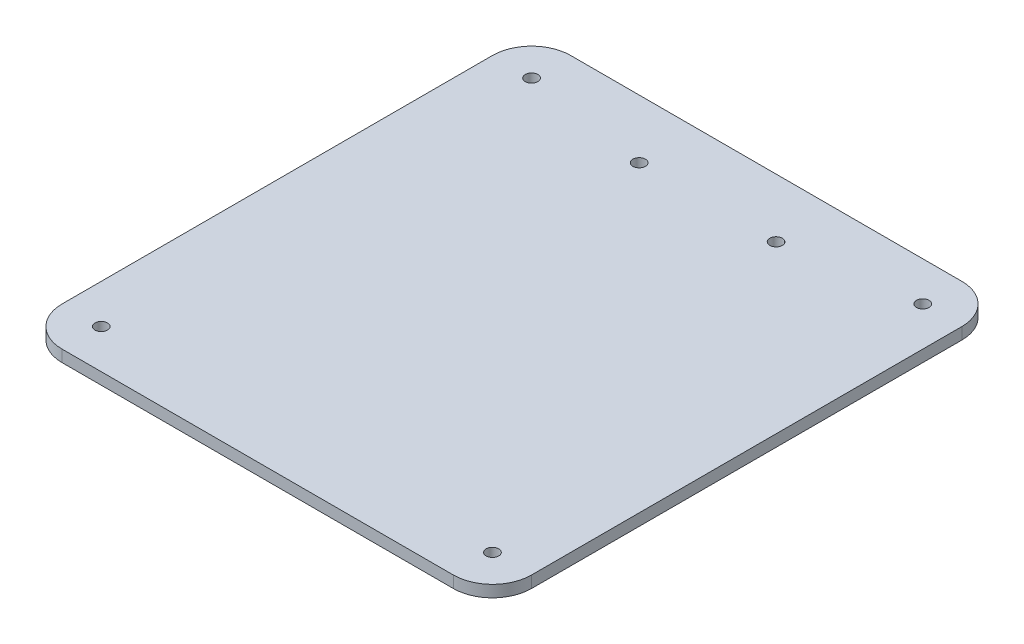
from build123d import *

# Parameters (mm, degrees)
SKETCH1_R           = 1.6
BOSS_EXTRUDE1_DEPTH = 3
SKETCH2_R           = 1.6
CUT_EXTRUDE1_DEPTH  = 89.509886453


with BuildPart() as part:
    # Sketch1 → Boss-Extrude1 (new body)
    with BuildSketch(Plane(origin=(0, 0, 0), x_dir=(1, 0, 0), z_dir=(0, 1, 0))):
        with BuildLine():
            Line((-50, 65), (50, 65))
            ThreePointArc((50, 65), (57.071067812, 62.071067812), (60, 55))
            Line((60, 55), (60, -55))
            ThreePointArc((60, -55), (57.071067812, -62.071067812), (50, -65))
            Line((50, -65), (-50, -65))
            ThreePointArc((-50, -65), (-57.071067812, -62.071067812), (-60, -55))
            Line((-60, -55), (-60, 55))
            ThreePointArc((-60, 55), (-57.071067812, 62.071067812), (-50, 65))
        make_face()
        with Locations(Location((50, -55, 0), (0, 0, 90))):
            Circle(SKETCH1_R, mode=Mode.SUBTRACT)
        with Locations(Location((-50, -55, 0), (0, 0, 270))):
            Circle(SKETCH1_R, mode=Mode.SUBTRACT)
        with Locations(Location((50, 55, 0), (0, 0, 270))):
            Circle(SKETCH1_R, mode=Mode.SUBTRACT)
        with Locations(Location((-50, 55, 0), (0, 0, 90))):
            Circle(SKETCH1_R, mode=Mode.SUBTRACT)
    extrude(amount=BOSS_EXTRUDE1_DEPTH)

    # Sketch2 → Cut-Extrude1 (cut, through all)
    with BuildSketch(Plane(origin=(0, 3, 0), x_dir=(1, 0, 0), z_dir=(0, 1, 0))):
        with Locations(Location((-17.5, 50, 0), (0, 0, 270))):
            Circle(SKETCH2_R)
        with Locations(Location((17.5, 50, 0), (0, 0, 270))):
            Circle(SKETCH2_R)
    extrude(amount=-CUT_EXTRUDE1_DEPTH, mode=Mode.SUBTRACT)


solid = part.part
